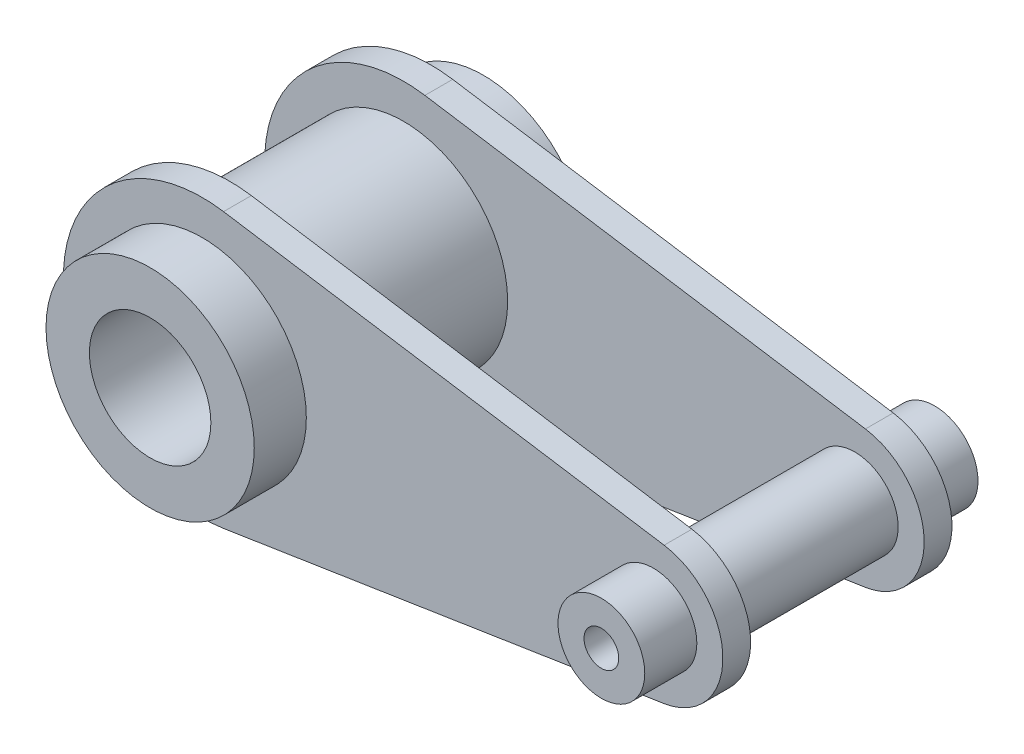
from build123d import *

# Parameters (mm, degrees)
SKETCH1_R             = 30
SKETCH1_R_2           = 17.5
BOSS_EXTRUDE1_DEPTH   = 48
SKETCH1_R_3           = 12.5
SKETCH1_R_4           = 5
BOSS_EXTRUDE1_2_DEPTH = 48
SKETCH2_R             = 30
SKETCH2_R_2           = 12.5
BOSS_EXTRUDE2_DEPTH   = 8


with BuildPart() as part:
    # Sketch1 → Boss-Extrude1 (new, symmetric)
    with BuildSketch(Plane.XY):
        with Locations((-65, 0)):
            Circle(SKETCH1_R)
        with Locations((-65, 0)):
            Circle(SKETCH1_R_2, mode=Mode.SUBTRACT)
    extrude(amount=BOSS_EXTRUDE1_DEPTH, both=True)



with BuildPart() as body_2:
    # Sketch1 → Boss-Extrude1 2 (new, symmetric)
    with BuildSketch(Plane.XY):
        with Locations((65, 0)):
            Circle(SKETCH1_R_3)
        with Locations((65, 0)):
            Circle(SKETCH1_R_4, mode=Mode.SUBTRACT)
    extrude(amount=BOSS_EXTRUDE1_2_DEPTH, both=True)


with BuildPart() as part_1:
    add(part.part)

    add(body_2.part)  # Boss-Extrude2 merges body 2
    # Sketch2 → Boss-Extrude2 (add)
    with BuildSketch(Plane.XY.offset(33)):
        with BuildLine():
            Line((68.076923077, -19.761896275), (-58.846153846, -39.52379255))
            ThreePointArc((-58.846153846, -39.52379255), (-105, 0), (-58.846153846, 39.52379255))
            Line((-58.846153846, 39.52379255), (68.076923077, 19.761896275))
            ThreePointArc((68.076923077, 19.761896275), (85, 0), (68.076923077, -19.761896275))
        make_face()
        with Locations((-65, 0)):
            Circle(SKETCH2_R, mode=Mode.SUBTRACT)
        with Locations((65, 0)):
            Circle(SKETCH2_R_2, mode=Mode.SUBTRACT)
    boss_extrude2 = extrude(amount=-BOSS_EXTRUDE2_DEPTH)

    # Mirror1: Boss-Extrude2 across plane
    add(boss_extrude2.mirror(Plane.XY))


solid = part_1.part
